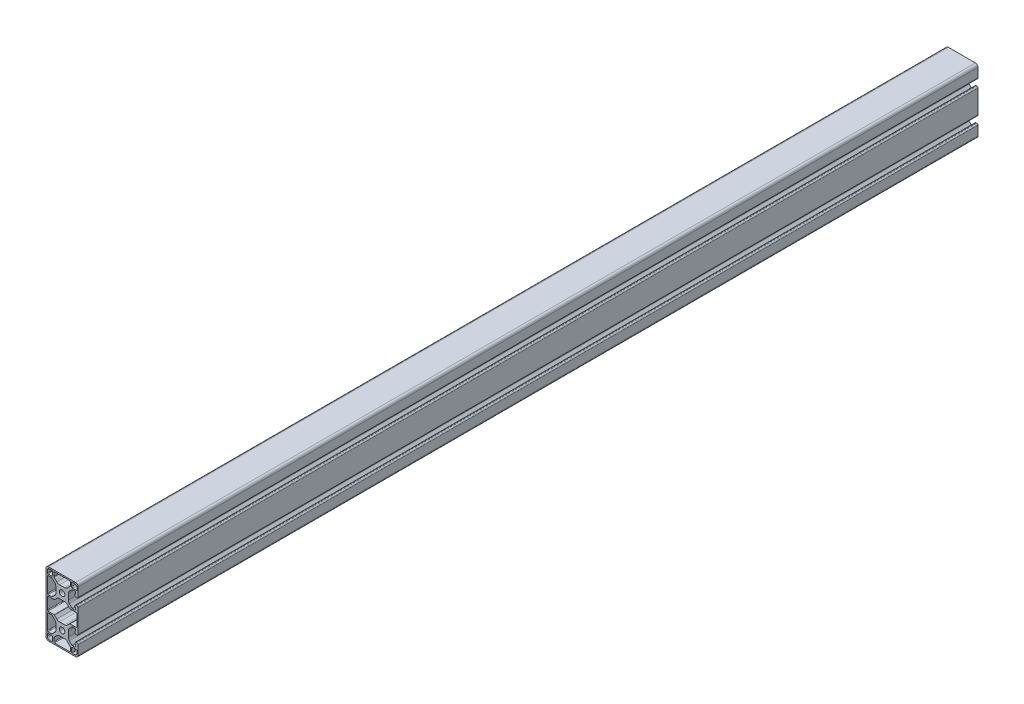
from build123d import *

# Parameters (mm, degrees)
SKETCH1_R           = 3.405
BOSS_EXTRUDE1_DEPTH = 1120


with BuildPart() as part:
    # Sketch1 → Boss-Extrude1 (new body)
    with BuildSketch(Plane(origin=(0, 0, -4000), x_dir=(-1, 0, 0), z_dir=(0, 0, -1))):
        with BuildLine():
            Line((20, -16.83), (20, 56.83))
            ThreePointArc((20, 56.83), (19.071528496, 59.071528496), (16.83, 60))
            Line((16.83, 60), (-16.83, 60))
            ThreePointArc((-16.83, 60), (-19.071528496, 59.071528496), (-20, 56.83))
            Line((-20, 56.83), (-20, 45.54033026))
            ThreePointArc((-20, 45.54033026), (-19.566421305, 44.493578695), (-18.51966974, 44.06))
            Line((-18.51966974, 44.06), (-17.80484913, 44.06))
            ThreePointArc((-17.80484913, 44.06), (-16.486201664, 44.606201664), (-15.94, 45.92484913))
            Line((-15.94, 45.92484913), (-15.94, 47.28072692))
            Line((-15.94, 47.28072692), (-16.7, 47.28072692))
            Line((-16.7, 47.28072692), (-16.7, 48.94832744))
            ThreePointArc((-16.7, 48.94832744), (-16.308497671, 49.893497671), (-15.36332744, 50.285))
            Line((-15.36332744, 50.285), (-12.987102448, 50.285))
            ThreePointArc((-12.987102448, 50.285), (-12.646514194, 50.217252784), (-12.357777413, 50.024325035))
            Line((-12.357777413, 50.024325035), (-9.091242789, 46.757790411))
            ThreePointArc((-9.091242789, 46.757790411), (-8.061572221, 45.216779505), (-7.7, 43.399033201))
            Line((-7.7, 43.399033201), (-7.7, 36.600966799))
            ThreePointArc((-7.7, 36.600966799), (-8.061572221, 34.783220495), (-9.091242789, 33.242209589))
            Line((-9.091242789, 33.242209589), (-12.357777413, 29.975674965))
            ThreePointArc((-12.357777413, 29.975674965), (-12.646514194, 29.782747216), (-12.987102448, 29.715))
            Line((-12.987102448, 29.715), (-15.36332744, 29.715))
            ThreePointArc((-15.36332744, 29.715), (-16.308497671, 30.106502329), (-16.7, 31.05167256))
            Line((-16.7, 31.05167256), (-16.7, 32.71927308))
            Line((-16.7, 32.71927308), (-15.94, 32.71927308))
            Line((-15.94, 32.71927308), (-15.94, 34.07515087))
            ThreePointArc((-15.94, 34.07515087), (-16.486201664, 35.393798336), (-17.80484913, 35.94))
            Line((-17.80484913, 35.94), (-18.51966974, 35.94))
            ThreePointArc((-18.51966974, 35.94), (-19.566421305, 35.506421305), (-20, 34.45966974))
            Line((-20, 34.45966974), (-20, 5.54033026))
            ThreePointArc((-20, 5.54033026), (-19.566421305, 4.493578695), (-18.51966974, 4.06))
            Line((-18.51966974, 4.06), (-17.80484913, 4.06))
            ThreePointArc((-17.80484913, 4.06), (-16.486201664, 4.606201664), (-15.94, 5.92484913))
            Line((-15.94, 5.92484913), (-15.94, 7.28072692))
            Line((-15.94, 7.28072692), (-16.7, 7.28072692))
            Line((-16.7, 7.28072692), (-16.7, 9.015))
            ThreePointArc((-16.7, 9.015), (-16.328025612, 9.913025612), (-15.43, 10.285))
            Line((-15.43, 10.285), (-12.987102448, 10.285))
            ThreePointArc((-12.987102448, 10.285), (-12.646514194, 10.217252784), (-12.357777413, 10.024325035))
            Line((-12.357777413, 10.024325035), (-9.091242789, 6.757790411))
            ThreePointArc((-9.091242789, 6.757790411), (-8.061572221, 5.216779505), (-7.7, 3.399033201))
            Line((-7.7, 3.399033201), (-7.7, -3.399033201))
            ThreePointArc((-7.7, -3.399033201), (-8.061572221, -5.216779505), (-9.091242789, -6.757790411))
            Line((-9.091242789, -6.757790411), (-12.357777413, -10.024325035))
            ThreePointArc((-12.357777413, -10.024325035), (-12.646514194, -10.217252784), (-12.987102448, -10.285))
            Line((-12.987102448, -10.285), (-15.36332744, -10.285))
            ThreePointArc((-15.36332744, -10.285), (-16.308497671, -9.893497671), (-16.7, -8.94832744))
            Line((-16.7, -8.94832744), (-16.7, -7.28072692))
            Line((-16.7, -7.28072692), (-15.94, -7.28072692))
            Line((-15.94, -7.28072692), (-15.94, -5.92484913))
            ThreePointArc((-15.94, -5.92484913), (-16.486201664, -4.606201664), (-17.80484913, -4.06))
            Line((-17.80484913, -4.06), (-18.51966974, -4.06))
            ThreePointArc((-18.51966974, -4.06), (-19.566421305, -4.493578695), (-20, -5.54033026))
            Line((-20, -5.54033026), (-20, -16.83))
            ThreePointArc((-20, -16.83), (-19.071528496, -19.071528496), (-16.83, -20))
            Line((-16.83, -20), (16.83, -20))
            ThreePointArc((16.83, -20), (19.071528496, -19.071528496), (20, -16.83))
        make_face()
        with Locations(Location((0, 40, 0), (0, 0, 180))):
            Circle(SKETCH1_R, mode=Mode.SUBTRACT)
        with Locations(Location((0, 0, 0), (0, 0, 180))):
            Circle(SKETCH1_R, mode=Mode.SUBTRACT)
        with BuildLine():
            Line((18.3499228, 55.5500772), (18.3499228, 52.5700772))
            ThreePointArc((18.3499228, 52.5700772), (18.165400072, 52.124599928), (17.7199228, 51.9400772))
            Line((17.7199228, 51.9400772), (13.2099228, 51.9400772))
            ThreePointArc((13.2099228, 51.9400772), (12.311897188, 52.312051588), (11.9399228, 53.2100772))
            Line((11.9399228, 53.2100772), (11.9399228, 57.7200772))
            ThreePointArc((11.9399228, 57.7200772), (12.124445528, 58.165554472), (12.5699228, 58.3500772))
            Line((12.5699228, 58.3500772), (15.5499228, 58.3500772))
            ThreePointArc((15.5499228, 58.3500772), (17.529821787, 57.529976187), (18.3499228, 55.5500772))
        make_face(mode=Mode.SUBTRACT)
        with BuildLine():
            Line((18.3499228, -12.5700772), (18.3499228, -15.5500772))
            ThreePointArc((18.3499228, -15.5500772), (17.529821787, -17.529976187), (15.5499228, -18.3500772))
            Line((15.5499228, -18.3500772), (12.5699228, -18.3500772))
            ThreePointArc((12.5699228, -18.3500772), (12.124445528, -18.165554472), (11.9399228, -17.7200772))
            Line((11.9399228, -17.7200772), (11.9399228, -13.2100772))
            ThreePointArc((11.9399228, -13.2100772), (12.311897188, -12.312051588), (13.2099228, -11.9400772))
            Line((13.2099228, -11.9400772), (17.7199228, -11.9400772))
            ThreePointArc((17.7199228, -11.9400772), (18.165400072, -12.124599928), (18.3499228, -12.5700772))
        make_face(mode=Mode.SUBTRACT)
        with BuildLine():
            Line((18.34920635, 27.17611111), (18.34920635, 12.82388889))
            ThreePointArc((18.34920635, 12.82388889), (18.088856822, 12.195349528), (17.46031746, 11.935))
            Line((17.46031746, 11.935), (9.970197693, 11.935))
            ThreePointArc((9.970197693, 11.935), (9.629609438, 11.867252784), (9.340872657, 11.674325035))
            Line((9.340872657, 11.674325035), (6.581173831, 8.914626209))
            ThreePointArc((6.581173831, 8.914626209), (5.040162925, 7.884955641), (3.222416621, 7.52338342))
            Line((3.222416621, 7.52338342), (-3.222416621, 7.52338342))
            ThreePointArc((-3.222416621, 7.52338342), (-5.040162925, 7.884955641), (-6.581173831, 8.914626209))
            Line((-6.581173831, 8.914626209), (-9.340872657, 11.674325035))
            ThreePointArc((-9.340872657, 11.674325035), (-9.629609438, 11.867252784), (-9.970197693, 11.935))
            Line((-9.970197693, 11.935), (-17.46031746, 11.935))
            ThreePointArc((-17.46031746, 11.935), (-18.088856822, 12.195349528), (-18.34920635, 12.82388889))
            Line((-18.34920635, 12.82388889), (-18.34920635, 27.17611111))
            ThreePointArc((-18.34920635, 27.17611111), (-18.088856822, 27.804650472), (-17.46031746, 28.065))
            Line((-17.46031746, 28.065), (-9.970197693, 28.065))
            ThreePointArc((-9.970197693, 28.065), (-9.629609438, 28.132747216), (-9.340872657, 28.325674965))
            Line((-9.340872657, 28.325674965), (-6.581173831, 31.085373791))
            ThreePointArc((-6.581173831, 31.085373791), (-5.040162925, 32.115044359), (-3.222416621, 32.47661658))
            Line((-3.222416621, 32.47661658), (3.222416621, 32.47661658))
            ThreePointArc((3.222416621, 32.47661658), (5.040162925, 32.115044359), (6.581173831, 31.085373791))
            Line((6.581173831, 31.085373791), (9.340872657, 28.325674965))
            ThreePointArc((9.340872657, 28.325674965), (9.629609438, 28.132747216), (9.970197693, 28.065))
            Line((9.970197693, 28.065), (17.46031746, 28.065))
            ThreePointArc((17.46031746, 28.065), (18.088856822, 27.804650472), (18.34920635, 27.17611111))
        make_face(mode=Mode.SUBTRACT)
        with BuildLine():
            Line((18.34920635, 9.39611111), (18.34920635, -9.39611111))
            ThreePointArc((18.34920635, -9.39611111), (18.088856822, -10.024650472), (17.46031746, -10.285))
            Line((17.46031746, -10.285), (12.987102448, -10.285))
            ThreePointArc((12.987102448, -10.285), (12.646514194, -10.217252784), (12.357777413, -10.024325035))
            Line((12.357777413, -10.024325035), (9.091242789, -6.757790411))
            ThreePointArc((9.091242789, -6.757790411), (8.061572221, -5.216779505), (7.7, -3.399033201))
            Line((7.7, -3.399033201), (7.7, 3.399033201))
            ThreePointArc((7.7, 3.399033201), (8.061572221, 5.216779505), (9.091242789, 6.757790411))
            Line((9.091242789, 6.757790411), (12.357777413, 10.024325035))
            ThreePointArc((12.357777413, 10.024325035), (12.646514194, 10.217252784), (12.987102448, 10.285))
            Line((12.987102448, 10.285), (17.46031746, 10.285))
            ThreePointArc((17.46031746, 10.285), (18.088856822, 10.024650472), (18.34920635, 9.39611111))
        make_face(mode=Mode.SUBTRACT)
        with BuildLine():
            Line((18.34920635, 49.39611111), (18.34920635, 30.60388889))
            ThreePointArc((18.34920635, 30.60388889), (18.088856822, 29.975349528), (17.46031746, 29.715))
            Line((17.46031746, 29.715), (12.987102448, 29.715))
            ThreePointArc((12.987102448, 29.715), (12.646514194, 29.782747216), (12.357777413, 29.975674965))
            Line((12.357777413, 29.975674965), (9.091242789, 33.242209589))
            ThreePointArc((9.091242789, 33.242209589), (8.061572221, 34.783220495), (7.7, 36.600966799))
            Line((7.7, 36.600966799), (7.7, 43.399033201))
            ThreePointArc((7.7, 43.399033201), (8.061572221, 45.216779505), (9.091242789, 46.757790411))
            Line((9.091242789, 46.757790411), (12.357777413, 50.024325035))
            ThreePointArc((12.357777413, 50.024325035), (12.646514194, 50.217252784), (12.987102448, 50.285))
            Line((12.987102448, 50.285), (17.46031746, 50.285))
            ThreePointArc((17.46031746, 50.285), (18.088856822, 50.024650472), (18.34920635, 49.39611111))
        make_face(mode=Mode.SUBTRACT)
        with BuildLine():
            Line((10.2899228, 57.46118831), (10.2899228, 52.992025248))
            ThreePointArc((10.2899228, 52.992025248), (10.222175584, 52.651436994), (10.029247835, 52.362700213))
            Line((10.029247835, 52.362700213), (6.581173831, 48.914626209))
            ThreePointArc((6.581173831, 48.914626209), (5.040162925, 47.884955641), (3.222416621, 47.52338342))
            Line((3.222416621, 47.52338342), (-3.222416621, 47.52338342))
            ThreePointArc((-3.222416621, 47.52338342), (-5.040162925, 47.884955641), (-6.581173831, 48.914626209))
            Line((-6.581173831, 48.914626209), (-10.029247835, 52.362700213))
            ThreePointArc((-10.029247835, 52.362700213), (-10.222175584, 52.651436994), (-10.2899228, 52.992025248))
            Line((-10.2899228, 52.992025248), (-10.2899228, 57.46118831))
            ThreePointArc((-10.2899228, 57.46118831), (-10.029573272, 58.089727672), (-9.40103391, 58.3500772))
            Line((-9.40103391, 58.3500772), (9.40103391, 58.3500772))
            ThreePointArc((9.40103391, 58.3500772), (10.029573272, 58.089727672), (10.2899228, 57.46118831))
        make_face(mode=Mode.SUBTRACT)
        with BuildLine():
            Line((10.2899228, -12.992025248), (10.2899228, -17.42161897))
            ThreePointArc((10.2899228, -17.42161897), (10.029573272, -18.050158332), (9.40103391, -18.31050786))
            Line((9.40103391, -18.31050786), (-9.40103391, -18.31050786))
            ThreePointArc((-9.40103391, -18.31050786), (-10.029573272, -18.050158332), (-10.2899228, -17.42161897))
            Line((-10.2899228, -17.42161897), (-10.2899228, -12.992025248))
            ThreePointArc((-10.2899228, -12.992025248), (-10.222175584, -12.651436994), (-10.029247835, -12.362700213))
            Line((-10.029247835, -12.362700213), (-6.581173831, -8.914626209))
            ThreePointArc((-6.581173831, -8.914626209), (-5.040162925, -7.884955641), (-3.222416621, -7.52338342))
            Line((-3.222416621, -7.52338342), (3.222416621, -7.52338342))
            ThreePointArc((3.222416621, -7.52338342), (5.040162925, -7.884955641), (6.581173831, -8.914626209))
            Line((6.581173831, -8.914626209), (10.029247835, -12.362700213))
            ThreePointArc((10.029247835, -12.362700213), (10.222175584, -12.651436994), (10.2899228, -12.992025248))
        make_face(mode=Mode.SUBTRACT)
        with BuildLine():
            Line((-11.9399228, 57.7200772), (-11.9399228, 53.2100772))
            ThreePointArc((-11.9399228, 53.2100772), (-12.311897188, 52.312051588), (-13.2099228, 51.9400772))
            Line((-13.2099228, 51.9400772), (-17.7199228, 51.9400772))
            ThreePointArc((-17.7199228, 51.9400772), (-18.165400072, 52.124599928), (-18.3499228, 52.5700772))
            Line((-18.3499228, 52.5700772), (-18.3499228, 55.5500772))
            ThreePointArc((-18.3499228, 55.5500772), (-17.529821787, 57.529976187), (-15.5499228, 58.3500772))
            Line((-15.5499228, 58.3500772), (-12.5699228, 58.3500772))
            ThreePointArc((-12.5699228, 58.3500772), (-12.124445528, 58.165554472), (-11.9399228, 57.7200772))
        make_face(mode=Mode.SUBTRACT)
        with BuildLine():
            Line((-11.9399228, -13.2100772), (-11.9399228, -17.7200772))
            ThreePointArc((-11.9399228, -17.7200772), (-12.124445528, -18.165554472), (-12.5699228, -18.3500772))
            Line((-12.5699228, -18.3500772), (-15.5499228, -18.3500772))
            ThreePointArc((-15.5499228, -18.3500772), (-17.529821787, -17.529976187), (-18.3499228, -15.5500772))
            Line((-18.3499228, -15.5500772), (-18.3499228, -12.5700772))
            ThreePointArc((-18.3499228, -12.5700772), (-18.165400072, -12.124599928), (-17.7199228, -11.9400772))
            Line((-17.7199228, -11.9400772), (-13.2099228, -11.9400772))
            ThreePointArc((-13.2099228, -11.9400772), (-12.311897188, -12.312051588), (-11.9399228, -13.2100772))
        make_face(mode=Mode.SUBTRACT)
    extrude(amount=-BOSS_EXTRUDE1_DEPTH)


solid = part.part
